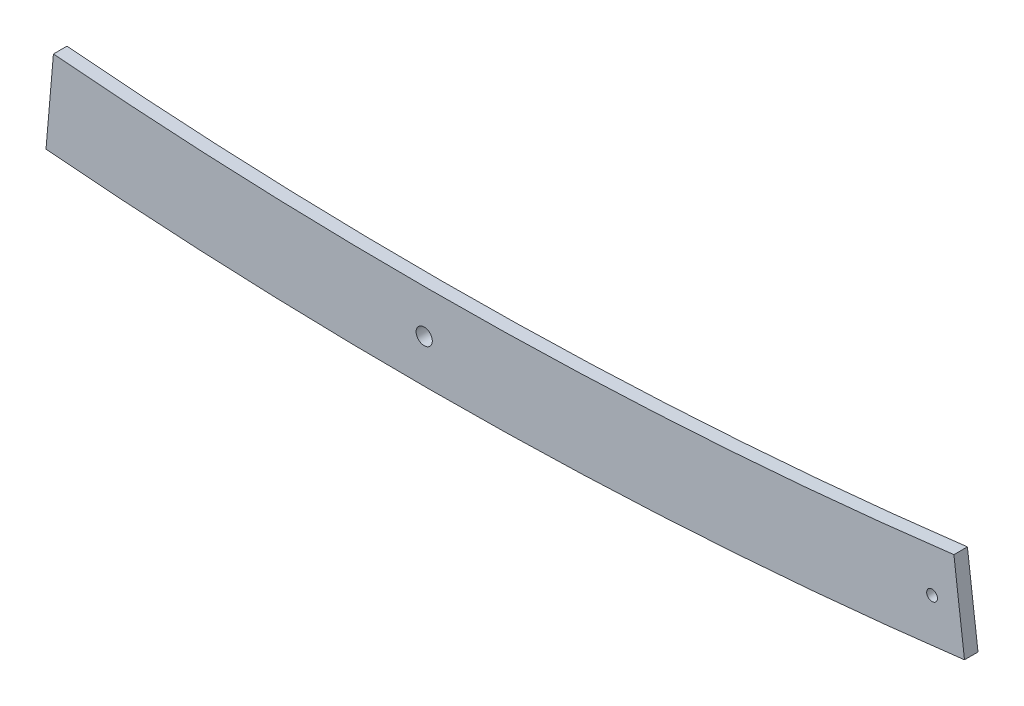
from build123d import *

# Parameters (mm, degrees)
BOSS_EXTRUDE1_DEPTH = 1.25
SKETCH2_R           = 1.5
CUT_EXTRUDE1_DEPTH  = 10
SKETCH3_R           = 1
CUT_EXTRUDE2_DEPTH  = 10


with BuildPart() as part:
    # Sketch1 → Boss-Extrude1 (new, symmetric)
    with BuildSketch(Plane.XY):
        with BuildLine():
            Line((100, 6.15063129), (98.039215686, 22.030030676))
            ThreePointArc((98.039215686, 22.030030676), (14.786349801, 16.13665926), (-68.62745098, 18.949014823))
            Line((-68.62745098, 18.949014823), (-70, 3.007995119))
            ThreePointArc((-70, 3.007995119), (15.082076797, 0.139392445), (100, 6.15063129))
        make_face()
    extrude(amount=BOSS_EXTRUDE1_DEPTH, both=True)

    # Sketch2 → Cut-Extrude1 (cut, symmetric)
    with BuildSketch(Plane.XY):
        with Locations((0, 8)):
            Circle(SKETCH2_R)
    extrude(amount=CUT_EXTRUDE1_DEPTH, both=True, mode=Mode.SUBTRACT)

    # Sketch3 → Cut-Extrude2 (cut, symmetric)
    with BuildSketch(Plane.XY):
        with Locations((94, 13.486995845)):
            Circle(SKETCH3_R)
    extrude(amount=CUT_EXTRUDE2_DEPTH, both=True, mode=Mode.SUBTRACT)


solid = part.part
